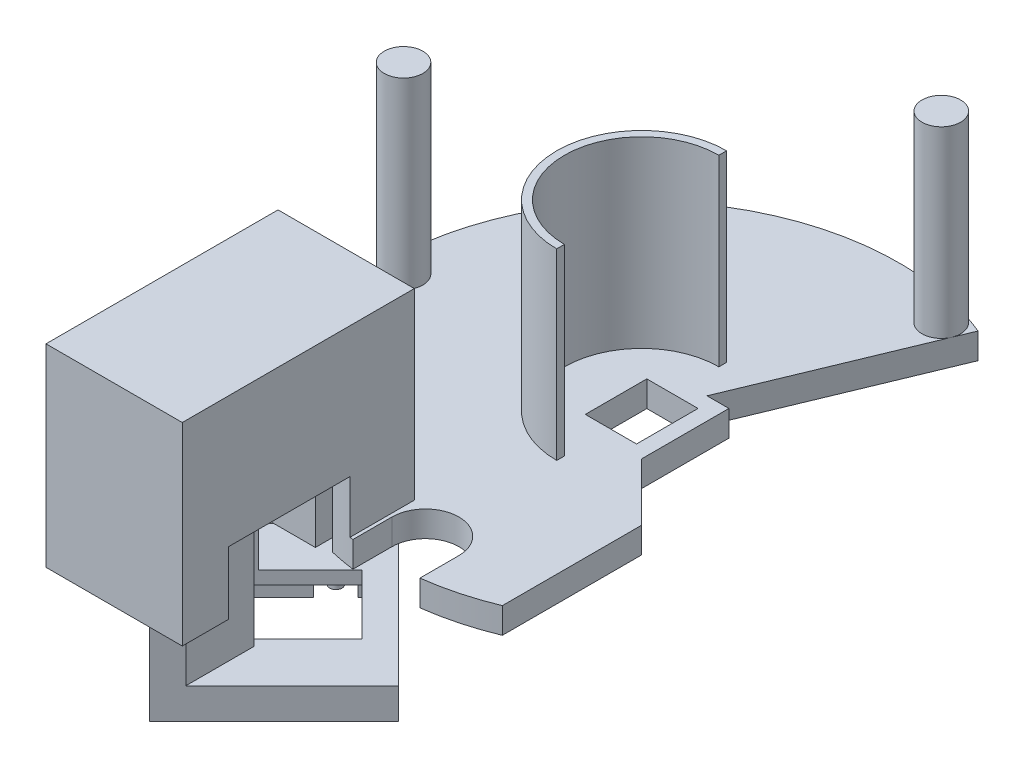
from build123d import *

# Parameters (mm, degrees)
SKETCH1_W               = 9.95
SKETCH1_H               = 11.95
BOSS_EXTRUDE2_DEPTH     = 5
BOSS_EXTRUDE6_DEPTH     = 35.6
SKETCH8_R               = 3.75
BOSS_EXTRUDE8_DEPTH     = 35.6
BOSS_EXTRUDE9_DEPTH     = 12.22
CUT_EXTRUDE1_DEPTH      = 104.199711628
CUT_EXTRUDE1_DEPTH_BACK = 104.199711628
SKETCH10_W              = 26.47
SKETCH10_H              = 45.066300886
BOSS_EXTRUDE10_DEPTH    = 25.38
CUT_EXTRUDE2_DEPTH      = 104.199711628
CUT_EXTRUDE2_DEPTH_BACK = 12.22
SKETCH11_W              = 3.704655087
SKETCH11_H              = 4.851710635
SKETCH14_R              = 1.2
SKETCH14_R_2            = 1.199999993
BOSS_EXTRUDE11_DEPTH    = 2.5
BOSS_EXTRUDE12_DEPTH    = 6
SKETCH17_R              = 1.199999993
BOSS_EXTRUDE13_DEPTH    = 6
CUT_EXTRUDE3_DEPTH      = 122.35580118
CUT_EXTRUDE3_DEPTH_BACK = 122.35580118
SKETCH18_W              = 20
SKETCH18_H              = 100
BOSS_EXTRUDE14_DEPTH    = 20
BOSS_EXTRUDE15_DEPTH    = 5
CUT_EXTRUDE4_START      = 30
CUT_EXTRUDE4_DEPTH      = 30
BOSS_EXTRUDE16_START    = 3
BOSS_EXTRUDE16_DEPTH    = 3
BOSS_EXTRUDE17_START    = 3
BOSS_EXTRUDE17_DEPTH    = 3
BOSS_EXTRUDE18_DEPTH    = 27.5


with BuildPart() as part:
    # Sketch1 → Boss-Extrude2 (new body)
    with BuildSketch(Plane(origin=(0, 0, 0), x_dir=(1, 0, 0), z_dir=(0, 1, 0))):
        with BuildLine():
            Line((35.355339059, -35.355339059), (7.975, -7.975))
            Line((7.975, -7.975), (7.975, 8.975))
            Line((7.975, 8.975), (3.717566722, 8.975))
            Line((3.717566722, 8.975), (19.134171618, 46.193976626))
            ThreePointArc((19.134171618, 46.193976626), (-48.299723588, 12.928136036), (-6.5, -49.575699692))
            Line((-6.5, -49.575699692), (-6.5, -42))
            ThreePointArc((-6.5, -42), (0, -35.5), (6.5, -42))
            Line((6.5, -42), (6.5, -49.575699692))
            ThreePointArc((6.5, -49.575699692), (22.102534155, -44.84950372), (35.355339059, -35.355339059))
        make_face()
        Rectangle(SKETCH1_W, SKETCH1_H, mode=Mode.SUBTRACT)
    extrude(amount=BOSS_EXTRUDE2_DEPTH)

    # Sketch4 → Boss-Extrude6 (add)
    with BuildSketch(Plane(origin=(0, 5, 0), x_dir=(1, 0, 0), z_dir=(0, 1, 0))):
        with BuildLine():
            Line((0, 16.5), (0, 15))
            ThreePointArc((0, 15), (-15, 0), (0, -15))
            Line((0, -15), (0, -16.5))
            ThreePointArc((0, -16.5), (-16.5, 0), (0, 16.5))
        make_face()
    extrude(amount=BOSS_EXTRUDE6_DEPTH)

    # Sketch8 → Boss-Extrude8 (add)
    with BuildSketch(Plane(origin=(0, 5, 0), x_dir=(1, 0, 0), z_dir=(0, 1, 0))):
        with Locations(Location((14.176286342, 44.023804987, 0), (0, 0, 72.150709005))):
            Circle(SKETCH8_R)
        with Locations(Location((29.944361597, -35.247662455, 0), (0, 0, 45))):
            Circle(SKETCH8_R)
        with Locations(Location((-46.25, 0, 0), (0, 0, 179.999564815))):
            Circle(SKETCH8_R)
    extrude(amount=BOSS_EXTRUDE8_DEPTH)

    # Sketch9 → Boss-Extrude9 (add)
    with BuildSketch(Plane(origin=(0, 3, 0), x_dir=(-1, 0, 0), z_dir=(0, -1, 0))):
        with BuildLine():
            Line((11.4, -79.075699692), (11.4, -73.075699692))
            Line((11.4, -73.075699692), (7.15, -73.075699692))
            Line((7.15, -73.075699692), (7.15, -82.075699692))
            Line((7.15, -82.075699692), (33.62, -82.075699692))
            Line((33.62, -82.075699692), (33.62, -37.009398806))
            ThreePointArc((33.62, -37.009398806), (24.345047627, -43.67285949), (13.8, -48.057881768))
            Line((13.8, -48.057881768), (13.8, -49.575699692))
            Line((13.8, -49.575699692), (30.62, -49.575699692))
            Line((30.62, -49.575699692), (30.62, -73.075699692))
            Line((30.62, -73.075699692), (13.8, -73.075699692))
            Line((13.8, -73.075699692), (13.8, -79.075699692))
            Line((13.8, -79.075699692), (11.4, -79.075699692))
        make_face()
        with BuildLine():
            Line((7.15, -37.009398806), (7.15, -49.486134422))
            ThreePointArc((7.15, -49.486134422), (9.283687764, -49.130572371), (11.4, -48.683056601))
            Line((11.4, -48.683056601), (11.4, -43.575699692))
            Line((11.4, -43.575699692), (13.8, -43.575699692))
            Line((13.8, -43.575699692), (13.8, -48.057881768))
            ThreePointArc((13.8, -48.057881768), (24.345047627, -43.67285949), (33.62, -37.009398806))
            Line((33.62, -37.009398806), (7.15, -37.009398806))
        make_face()
    extrude(amount=-BOSS_EXTRUDE9_DEPTH)

    # Sketch9<3> → Cut-Extrude1 (cut, two sides: drawn at the far end of the back side and taken through both)
    with BuildSketch(Plane(origin=(0, 3, 0), x_dir=(-1, 0, 0), z_dir=(0, -1, 0)).offset(-CUT_EXTRUDE1_DEPTH_BACK)):
        with BuildLine():
            Line((7.15, -73.075699692), (11.4, -73.075699692))
            Line((11.4, -73.075699692), (11.4, -79.075699692))
            Line((11.4, -79.075699692), (13.8, -79.075699692))
            Line((13.8, -79.075699692), (13.8, -73.075699692))
            Line((13.8, -73.075699692), (30.62, -73.075699692))
            Line((30.62, -73.075699692), (30.62, -49.575699692))
            Line((30.62, -49.575699692), (13.8, -49.575699692))
            Line((13.8, -49.575699692), (13.8, -48.057881768))
            ThreePointArc((13.8, -48.057881768), (12.60387682, -48.38535201), (11.4, -48.683056601))
            Line((11.4, -48.683056601), (11.4, -49.575699692))
            Line((11.4, -49.575699692), (7.15, -49.575699692))
            Line((7.15, -49.575699692), (7.15, -73.075699692))
        make_face()
        with BuildLine():
            Line((11.4, -43.575699692), (11.4, -48.683056601))
            ThreePointArc((11.4, -48.683056601), (12.60387682, -48.38535201), (13.8, -48.057881768))
            Line((13.8, -48.057881768), (13.8, -43.575699692))
            Line((13.8, -43.575699692), (11.4, -43.575699692))
        make_face()
    extrude(amount=CUT_EXTRUDE1_DEPTH + CUT_EXTRUDE1_DEPTH_BACK, mode=Mode.SUBTRACT)

    # Sketch10 → Boss-Extrude10 (add)
    with BuildSketch(Plane(origin=(0, 15.22, 0), x_dir=(1, 0, 0), z_dir=(0, 1, 0))):
        with Locations((-20.385, -59.542549249)):
            Rectangle(SKETCH10_W, SKETCH10_H)
    extrude(amount=BOSS_EXTRUDE10_DEPTH)

    # Sketch11 → Cut-Extrude2 (cut, two sides: drawn at the far end of the back side and taken through both)
    with BuildSketch(Plane.XZ.offset(-3).offset(-CUT_EXTRUDE2_DEPTH_BACK)):
        with Locations((-28.767672457, 47.149844375)):
            Rectangle(SKETCH11_W, SKETCH11_H)
    extrude(amount=CUT_EXTRUDE2_DEPTH + CUT_EXTRUDE2_DEPTH_BACK, mode=Mode.SUBTRACT)

    # Sketch18 → Cut-Extrude3 (cut, two sides: drawn at the far end of the back side and taken through both)
    with BuildSketch(Plane.XZ.offset(33.5).offset(-CUT_EXTRUDE3_DEPTH_BACK)):
        with Locations((29.134171618, 3.806023374)):
            Rectangle(SKETCH18_W, SKETCH18_H)
    extrude(amount=CUT_EXTRUDE3_DEPTH + CUT_EXTRUDE3_DEPTH_BACK, mode=Mode.SUBTRACT)

    # Sketch20 → Boss-Extrude15 (add)
    with BuildSketch(Plane(origin=(0, 5, 0), x_dir=(1, 0, 0), z_dir=(0, 1, 0))):
        Polygon((-61.447579228, -34.153257501), (-44.858284064, -17.563962337), (-37.009398806, -25.412847595), (-53.59869397, -42.002142759), align=None)
        Polygon((-42.002142759, -53.59869397), (-34.153257487, -61.447579241), (-17.563962324, -44.858284077), (-25.412847595, -37.009398806), align=None)
    extrude(amount=-BOSS_EXTRUDE15_DEPTH)

    # Sketch21 → Cut-Extrude4 (cut)
    with BuildSketch(Plane.XZ.offset(-15.22).offset(CUT_EXTRUDE4_START)):
        with BuildLine():
            Line((-7.15, 49.486134422), (-7.15, 73.075699692))
            Line((-7.15, 73.075699692), (-11.4, 73.075699692))
            Line((-11.4, 73.075699692), (-11.4, 79.075699692))
            Line((-11.4, 79.075699692), (-13.8, 79.075699692))
            Line((-13.8, 79.075699692), (-13.8, 73.075699692))
            Line((-13.8, 73.075699692), (-30.62, 73.075699692))
            Line((-30.62, 73.075699692), (-30.62, 44.723989057))
            Line((-30.62, 44.723989057), (-26.915344913, 44.723989057))
            Line((-26.915344913, 44.723989057), (-26.915344913, 49.575699692))
            Line((-26.915344913, 49.575699692), (-13.8, 49.575699692))
            Line((-13.8, 49.575699692), (-13.8, 43.575699692))
            Line((-13.8, 43.575699692), (-11.4, 43.575699692))
            Line((-11.4, 43.575699692), (-11.4, 48.683056601))
            ThreePointArc((-11.4, 48.683056601), (-9.283687764, 49.130572371), (-7.15, 49.486134422))
        make_face()
    extrude(amount=-CUT_EXTRUDE4_DEPTH, mode=Mode.SUBTRACT)

    # Sketch22 → Boss-Extrude16 (add)
    with BuildSketch(Plane.XZ.offset(-3).offset(BOSS_EXTRUDE16_START)):
        with BuildLine():
            Line((-29.078364141, 40.674915352), (-33.62, 45.216551211))
            Line((-33.62, 45.216551211), (-33.62, 37.009398806))
            ThreePointArc((-33.62, 37.009398806), (-31.402710382, 38.908479547), (-29.078364141, 40.674915352))
        make_face()
    extrude(amount=-BOSS_EXTRUDE16_DEPTH)

    # Sketch23 → Boss-Extrude17 (add)
    with BuildSketch(Plane.XZ.offset(-3).offset(BOSS_EXTRUDE17_START)):
        with BuildLine():
            Line((-22.281377939, 49.575699692), (-18.968096289, 46.262418043))
            ThreePointArc((-18.968096289, 46.262418043), (-16.408624443, 47.23089078), (-13.8, 48.057881768))
            Line((-13.8, 48.057881768), (-13.8, 49.575699692))
            Line((-13.8, 49.575699692), (-22.281377939, 49.575699692))
        make_face()
    extrude(amount=-BOSS_EXTRUDE17_DEPTH)



with BuildPart() as body_2:
    # Sketch14 → Boss-Extrude11 (new body)
    with BuildSketch(Plane(origin=(0, -30, 0), x_dir=(-1, 0, 0), z_dir=(0, -1, 0))):
        with BuildLine():
            Line((24.642671324, -39.067649661), (26.445793573, -40.870771909))
            Line((26.445793573, -40.870771909), (27.860007135, -39.456558346))
            Line((27.860007135, -39.456558346), (21.354624748, -32.951175959))
            Line((21.354624748, -32.951175959), (32.951175959, -21.354624748))
            Line((32.951175959, -21.354624748), (39.456558346, -27.860007135))
            Line((39.456558346, -27.860007135), (40.870771909, -26.445793573))
            Line((40.870771909, -26.445793573), (39.067649617, -24.64267128))
            Line((39.067649617, -24.64267128), (41.224325286, -22.485995585))
            ThreePointArc((41.224325286, -22.485995585), (41.22432526, -18.17264422), (36.910973895, -18.172644246))
            Line((36.910973895, -18.172644246), (34.754298225, -20.329319941))
            Line((34.754298225, -20.329319941), (32.951175922, -18.52619766))
            Line((32.951175922, -18.52619766), (18.526197623, -32.951175959))
            Line((18.526197623, -32.951175959), (20.329319959, -34.754298295))
            Line((20.329319959, -34.754298295), (18.172644276, -36.910973978))
            ThreePointArc((18.172644276, -36.910973978), (18.172644276, -41.224325343), (22.485995642, -41.224325343))
            Line((22.485995642, -41.224325343), (24.642671324, -39.067649661))
        make_face()
        with Locations(Location((20.329319959, -39.067649661, 0), (0, 0, 90))):
            Circle(SKETCH14_R, mode=Mode.SUBTRACT)
        with Locations(Location((39.06764959, -20.329319915, 0), (0, 0, 90))):
            Circle(SKETCH14_R_2, mode=Mode.SUBTRACT)
    extrude(amount=-BOSS_EXTRUDE11_DEPTH)

    # Sketch15 → Boss-Extrude12 (add)
    with BuildSketch(Plane(origin=(0, -27.5, 0), x_dir=(1, 0, 0), z_dir=(0, 1, 0))):
        with BuildLine():
            Line((-40.870771909, -26.445793573), (-47.305443604, -20.011121877))
            Line((-47.305443604, -20.011121877), (-37.264527312, -9.970205584))
            Line((-37.264527312, -9.970205584), (-9.970205571, -37.264527325))
            Line((-9.970205571, -37.264527325), (-20.011121864, -47.305443618))
            Line((-20.011121864, -47.305443618), (-26.445793573, -40.870771909))
            Line((-26.445793573, -40.870771909), (-24.642671324, -39.067649661))
            Line((-24.642671324, -39.067649661), (-22.485995642, -41.224325343))
            ThreePointArc((-22.485995642, -41.224325343), (-18.172644276, -41.224325343), (-18.172644276, -36.910973978))
            Line((-18.172644276, -36.910973978), (-20.329319959, -34.754298295))
            Line((-20.329319959, -34.754298295), (-18.526197623, -32.951175959))
            Line((-18.526197623, -32.951175959), (-32.951175922, -18.52619766))
            Line((-32.951175922, -18.52619766), (-34.754298225, -20.329319941))
            Line((-34.754298225, -20.329319941), (-36.910973895, -18.172644246))
            ThreePointArc((-36.910973895, -18.172644246), (-41.22432526, -18.17264422), (-41.224325286, -22.485995585))
            Line((-41.224325286, -22.485995585), (-39.067649617, -24.64267128))
            Line((-39.067649617, -24.64267128), (-40.870771909, -26.445793573))
        make_face()
    extrude(amount=-BOSS_EXTRUDE12_DEPTH)

    # Sketch17 → Boss-Extrude13 (add)
    with BuildSketch(Plane(origin=(0, -27.5, 0), x_dir=(1, 0, 0), z_dir=(0, 1, 0))):
        with Locations(Location((-39.06764959, -20.329319915, 0), (0, 0, 270))):
            Circle(SKETCH17_R)
        with Locations(Location((-20.329319959, -39.067649661, 0), (0, 0, 270))):
            Circle(SKETCH17_R)
    extrude(amount=-BOSS_EXTRUDE13_DEPTH)

    # Sketch19 → Boss-Extrude14 (add)
    with BuildSketch(Plane(origin=(-33.658282741, 0, 33.658282741), x_dir=(0.7071067811865464, 0, 0.7071067811865488), z_dir=(-0.7071067811865488, 0, 0.7071067811865464))):
        Polygon((8.2, -30), (10.2, -30), (10.2, -33.5), (19.3, -33.5), (19.3, -27.5), (8.2, -27.5), align=None)
        Polygon((-10.2, -30), (-8.2, -30), (-8.2, -27.5), (-19.299999981, -27.5), (-19.299999981, -33.5), (-10.2, -33.5), align=None)
    extrude(amount=BOSS_EXTRUDE14_DEPTH)


with BuildPart() as part_1:
    add(part.part)

    add(body_2.part)  # Boss-Extrude18 merges body 2
    # Sketch24 → Boss-Extrude18 (add)
    with BuildSketch(Plane.XZ):
        Polygon((-61.447579228, 34.153257501), (-53.59869397, 42.002142759), (-42.992092252, 31.395541041), (-50.84097751, 23.546655783), align=None)
        Polygon((-34.153257487, 61.447579241), (-30.62, 57.914321754), (-30.62, 44.723989057), (-33.62, 45.216551211), (-42.002142759, 53.59869397), align=None)
    extrude(amount=BOSS_EXTRUDE18_DEPTH)


solid = part_1.part
